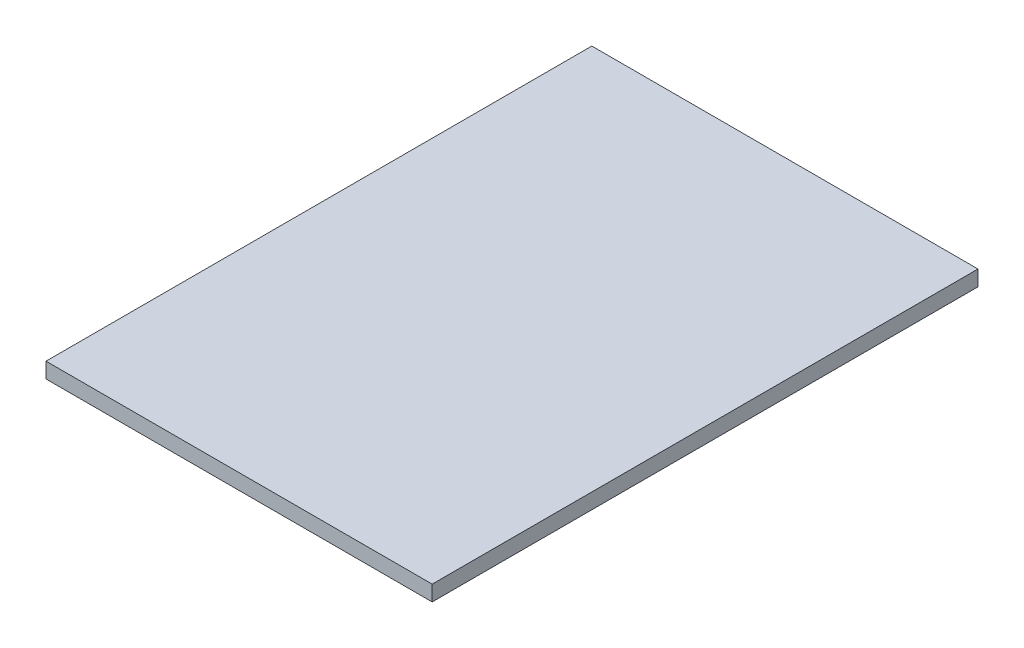
from build123d import *

# Parameters (mm, degrees)
CROQUIS1_W              = 75
CROQUIS1_H              = 106
SALIENTE_EXTRUIR1_DEPTH = 3


with BuildPart() as part:
    # Croquis1 → Saliente-Extruir1 (new body)
    with BuildSketch(Plane(origin=(0, 0, 0), x_dir=(1, 0, 0), z_dir=(0, 1, 0))):
        with Locations((37.5, 53)):
            Rectangle(CROQUIS1_W, CROQUIS1_H)
    extrude(amount=SALIENTE_EXTRUIR1_DEPTH)


solid = part.part
